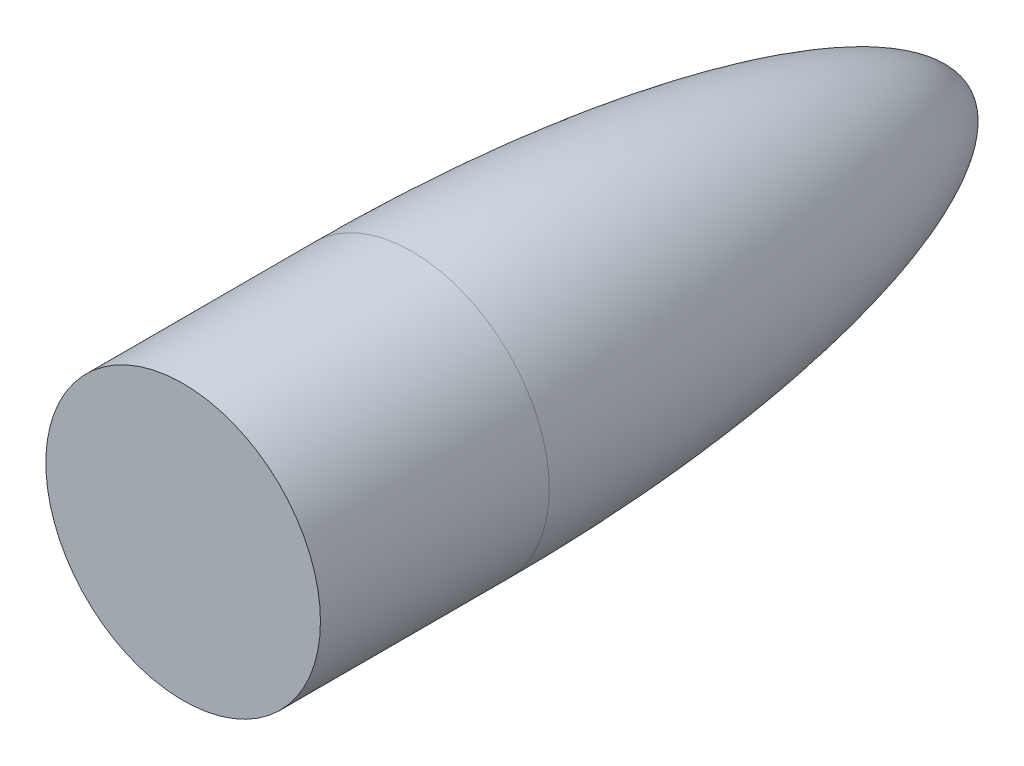
from build123d import *

# Parameters (mm, degrees)
SKETCH2_R           = 76.2
BOSS_EXTRUDE1_DEPTH = 127


with BuildPart() as part:
    # Sketch1 → Revolve1 (revolve)
    with BuildSketch(Plane(origin=(0, 0, 0), x_dir=(0, 0, -1), z_dir=(1, 0, 0))):
        with BuildLine():
            Line((0, 76.2), (0, 0))
            Line((0, 0), (304.8, 0))
            add(Edge.make_bspline(
                [(0, 76.2), (0.671133463, 76.2), (2.023265319, 76.198822492), (5.276247957, 76.191757441), (9.452435748, 76.167026156), (14.726348104, 76.117545572), (20.51425174, 76.032649472), (26.429561889, 75.919319453), (32.269989421, 75.777438685), (38.154069005, 75.606860132), (44.010403891, 75.40740554), (49.88194385, 75.178864924), (55.742400312, 74.92099478), (61.607463999, 74.633517898), (67.467364109, 74.316120003), (73.327724428, 73.968451037), (79.184898173, 73.590118195), (85.040708317, 73.180691625), (92.357153843, 72.629439007), (101.13212406, 71.903745087), (111.361129822, 70.960957097), (123.0380813, 69.746151307), (134.699118227, 68.387405111), (146.341577132, 66.876933899), (157.961963267, 65.205278926), (169.556420782, 63.361316003), (181.119671143, 61.331197113), (192.645885152, 59.098627001), (206.996537877, 56.028529221), (224.106235057, 51.846790659), (241.454240172, 46.793374651), (258.45701636, 40.659680658), (271.607441704, 34.77422735), (280.667817924, 29.899459648), (287.593205526, 25.400134679), (292.625625405, 21.462485274), (296.304852606, 17.990165256), (298.968593496, 14.94937932), (300.910177316, 12.247665763), (302.325687862, 9.805459806), (303.347876695, 7.558589379), (304.062033092, 5.458575046), (304.558560024, 3.326081323), (304.752906125, 1.711014456), (304.79995145, 0.613054441), (304.8, 0)],
                knots=[0.085310377, 0.085310377, 0.085310377, 0.085310377, 0.085310377, 0.093524034, 0.10173769, 0.118165003, 0.134592316, 0.151019628, 0.167446941, 0.183874254, 0.200301566, 0.216728879, 0.233156192, 0.249583505, 0.266010818, 0.282438131, 0.298865443, 0.315292756, 0.331720069, 0.348147382, 0.381002008, 0.413856633, 0.446711258, 0.479565882, 0.512420507, 0.545275131, 0.578129754, 0.610984378, 0.643839006, 0.676693634, 0.742402874, 0.808112112, 0.845998907, 0.878853412, 0.903557964, 0.923168772, 0.938339377, 0.950287386, 0.960109072, 0.968354492, 0.97552591, 0.981835872, 0.987698692, 0.993143136, 1, 1, 1, 1, 1], degree=4))
        make_face()
    revolve(axis=Axis((0, 0, -480.06), (0, 0, 1)))

    # Sketch2 → Boss-Extrude1 (add)
    with BuildSketch(Plane.XY):
        Circle(SKETCH2_R)
    extrude(amount=BOSS_EXTRUDE1_DEPTH)


solid = part.part
